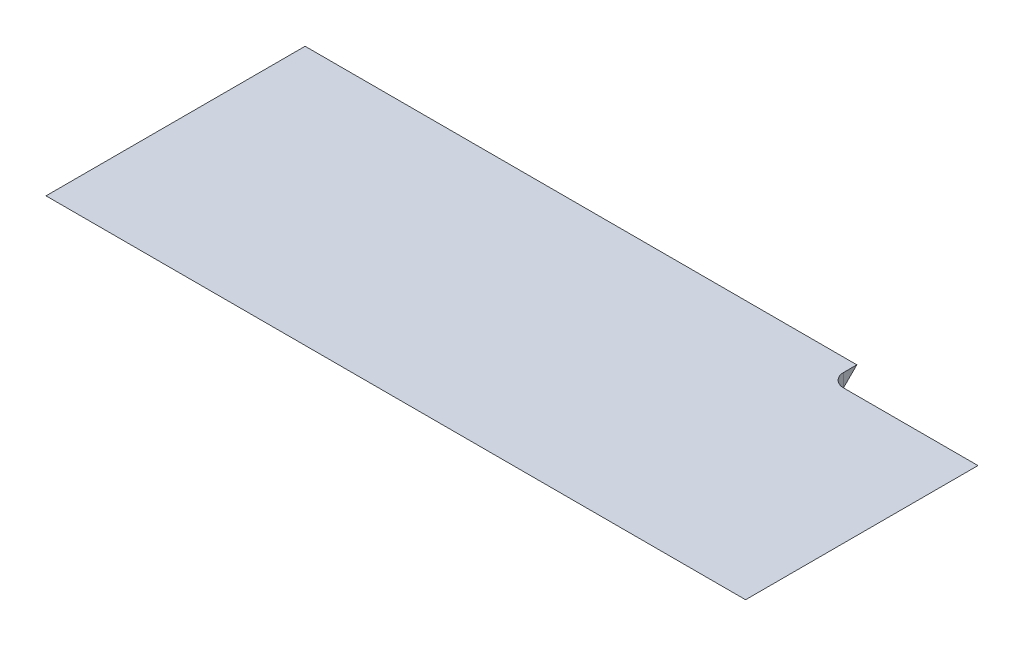
from build123d import *

# Parameters (mm, degrees)
SKETCH1_W           = 342.9
SKETCH1_H           = 127
BOSS_EXTRUDE1_DEPTH = 12.7
DRAFT1_ANGLE        = -45
SKETCH2_W           = 23.368
SKETCH2_H           = 127
CUT_EXTRUDE1_DEPTH  = 5.08
CUT_EXTRUDE2_DEPTH  = 5.08
SKETCH4_W           = 81.661
SKETCH4_H           = 26.162
CUT_EXTRUDE3_DEPTH  = 5.08
SKETCH5_W           = 72.464825645
SKETCH5_H           = 13.081
CUT_EXTRUDE4_DEPTH  = 184.272045059
FILLET1_R           = 6.604


with BuildPart() as part:
    # Sketch1 → Boss-Extrude1 (new body)
    with BuildSketch(Plane(origin=(0, 0, 0), x_dir=(1, 0, 0), z_dir=(0, 1, 0))):
        Rectangle(SKETCH1_W, SKETCH1_H)
    extrude(amount=-BOSS_EXTRUDE1_DEPTH)

    # Draft1
    draft1_faces = [part.faces().sort_by_distance(p)[0] for p in [
        (0, -6.35, -63.5),
        (-171.45, -6.35, 0),
        (171.45, -6.35, 0),
        (0, -6.35, 63.5),
    ]]
    draft(draft1_faces, Plane.ZX, DRAFT1_ANGLE)

    # Sketch2 → Cut-Extrude1 (cut)
    with BuildSketch(Plane.XZ.offset(12.7)):
        with Locations((12.446, 0)):
            Rectangle(SKETCH2_W, SKETCH2_H)
    extrude(amount=-CUT_EXTRUDE1_DEPTH, mode=Mode.SUBTRACT)

    # Sketch3 → Cut-Extrude2 (cut)
    with BuildSketch(Plane.XZ.offset(12.7)):
        with BuildLine():
            Line((0.762, 55.88), (-19.431, 55.88))
            Line((-19.431, 55.88), (-19.431, 30.988))
            ThreePointArc((-19.431, 30.988), (-12.827, 24.384), (-6.223, 30.988))
            Line((-6.223, 30.988), (0.762, 30.988))
            Line((0.762, 30.988), (0.762, 55.88))
        make_face()
    extrude(amount=-CUT_EXTRUDE2_DEPTH, mode=Mode.SUBTRACT)

    # Sketch4 → Cut-Extrude3 (cut)
    with BuildSketch(Plane.XZ.offset(12.7)):
        with Locations((130.6195, -50.419)):
            Rectangle(SKETCH4_W, SKETCH4_H)
    extrude(amount=-CUT_EXTRUDE3_DEPTH, mode=Mode.SUBTRACT)

    # Sketch5 → Cut-Extrude4 (cut, through all)
    with BuildSketch(Plane.XZ.offset(12.7)):
        with Locations((135.217587178, -56.9595)):
            Rectangle(SKETCH5_W, SKETCH5_H)
    extrude(amount=-CUT_EXTRUDE4_DEPTH, mode=Mode.SUBTRACT)

    # Fillet1
    fillet1_edges = [part.edges().sort_by_distance(p)[0] for p in [
        (98.985174355, -3.81, -50.419),
    ]]
    fillet(fillet1_edges, radius=FILLET1_R)


solid = part.part
